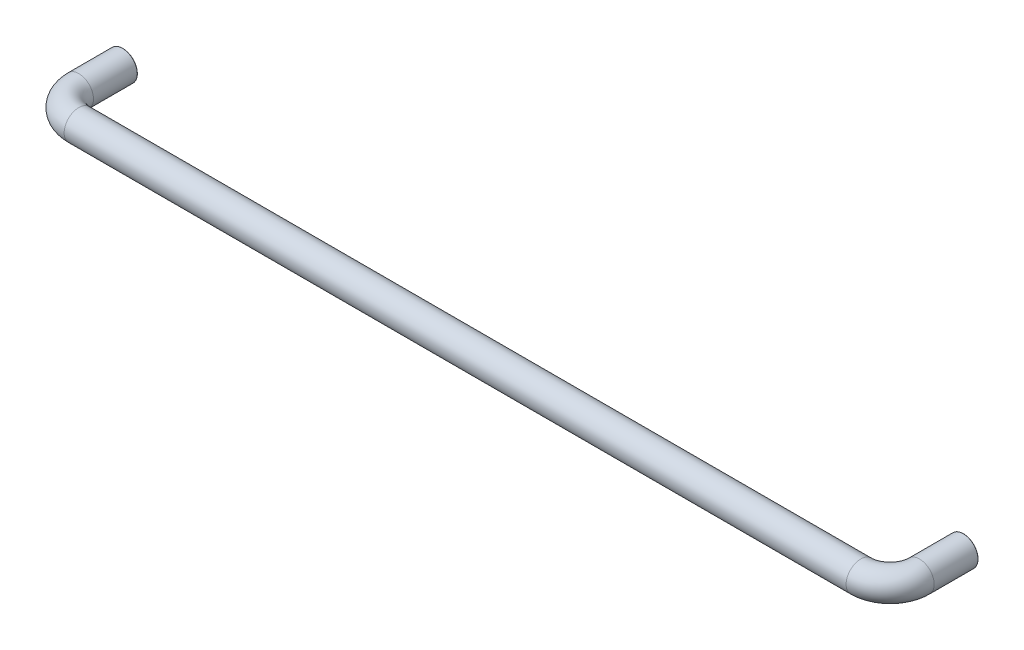
from build123d import *

# Parameters (mm, degrees)
SKETCH2_R   = 101.6
SKETCH2_R_2 = 88.9
FILLET1_R   = 2.54


with BuildPart() as part:
    # Sweep1: sweep along a path in Sketch1
    with BuildLine(Plane(origin=(0, 0, 0), x_dir=(1, 0, 0), z_dir=(0, 1, 0))) as sweep1_path:
        Line((-2908.3, 508), (-2908.3, 203.2))
        ThreePointArc((-2908.3, 203.2), (-2848.784097937, 59.515902063), (-2705.1, 0))
        Line((-2705.1, 0), (2705.1, 0))
        ThreePointArc((2705.1, 0), (2848.784097937, 59.515902063), (2908.3, 203.2))
        Line((2908.3, 203.2), (2908.3, 508))
    # Sketch2 → Sweep1 (sweep)
    with BuildSketch(Plane.XY.offset(-508)):
        with Locations((-2908.3, 0)):
            Circle(SKETCH2_R)
        with Locations((-2908.3, 0)):
            Circle(SKETCH2_R_2, mode=Mode.SUBTRACT)
    sweep(path=sweep1_path.line)

    # Fillet1
    fillet1_edges = [part.edges().sort_by_distance(p)[0] for p in [
        (3009.9, 0, -508),
        (-3009.9, 0, -508),
    ]]
    fillet(fillet1_edges, radius=FILLET1_R)


solid = part.part
